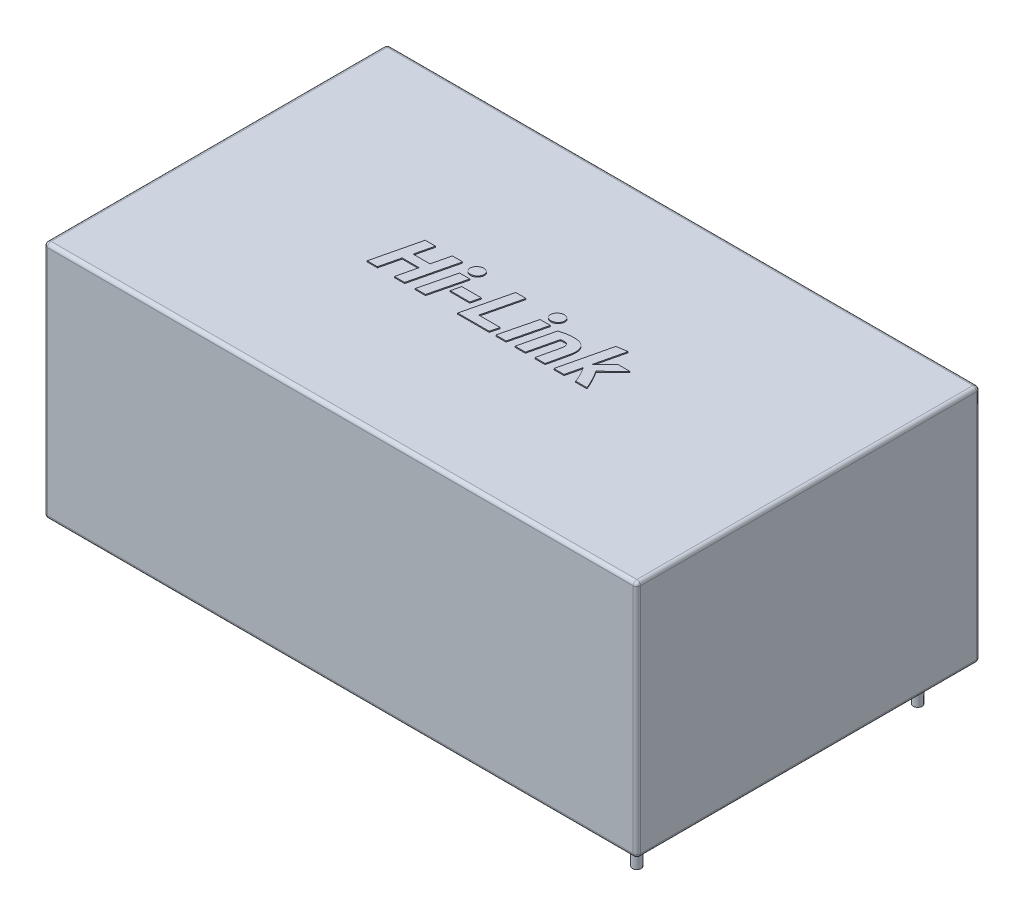
from build123d import *

# Parameters (mm, degrees)
SKETCH1_W           = 57
SKETCH1_H           = 33
BOSS_EXTRUDE2_DEPTH = 23
SKETCH2_R           = 0.423333333
BOSS_EXTRUDE3_DEPTH = 3.5
BOSS_EXTRUDE4_DEPTH = 0.1
FILLET1_R           = 0.35


with BuildPart() as part:
    # Sketch1 → Boss-Extrude2 (new body)
    with BuildSketch(Plane(origin=(0, 0, 0), x_dir=(1, 0, 0), z_dir=(0, 1, 0))):
        with Locations((28.5, 16.5)):
            Rectangle(SKETCH1_W, SKETCH1_H)
    extrude(amount=BOSS_EXTRUDE2_DEPTH)

    # Sketch2 → Boss-Extrude3 (add)
    with BuildSketch(Plane.XZ):
        with Locations(Location((3, -12, 0), (0, 0, 270))):
            Circle(SKETCH2_R)
        with Locations(Location((3, -21, 0), (0, 0, 270))):
            Circle(SKETCH2_R)
        with Locations(Location((54, -30, 0), (0, 0, 270))):
            Circle(SKETCH2_R)
        with Locations(Location((54, -3, 0), (0, 0, 270))):
            Circle(SKETCH2_R)
    extrude(amount=BOSS_EXTRUDE3_DEPTH)

    # Sketch3 → Boss-Extrude4 (add)
    with BuildSketch(Plane(origin=(0, 23, 0), x_dir=(1, 0, 0), z_dir=(0, 1, 0))):
        Polygon((20.950002418, 18.322835056), (21.935314918, 18.322835056), (20.855314918, 13.822835056), (19.870002418, 13.822835056), (20.330314918, 15.742835056), (18.701877418, 15.742835056), (18.240627418, 13.822835056), (17.255314918, 13.822835056), (18.335314918, 18.322835056), (19.320627418, 18.322835056), (18.903439918, 16.582835056), (20.531877418, 16.582835056), align=None)
        Polygon((22.861564918, 13.822835056), (21.875314918, 13.822835056), (22.715314918, 17.242835056), (23.701564918, 17.242835056), align=None)
        with BuildLine():
            add(Edge.make_bspline(
                [(23.339689918, 17.662835056), (23.306433979, 17.664232758), (23.240700813, 17.666995436), (23.144726031, 17.690440037), (23.053704894, 17.728542669), (22.968988952, 17.78001861), (22.894099689, 17.846886831), (22.843544719, 17.934760044), (22.81096536, 18.036511577), (22.807882478, 18.109740561), (22.806252418, 18.148460056)],
                knots=[0, 0, 0, 0, 0.983255354, 1.943487056, 2.90545464, 3.89378719, 4.868872819, 5.839693595, 6.857747755, 8, 8, 8, 8], degree=3))
            add(Edge.make_bspline(
                [(22.806252418, 18.148460056), (22.807040649, 18.170686916), (22.8086143, 18.215061382), (22.81917655, 18.280419225), (22.835932775, 18.344082619), (22.8685501, 18.424629599), (22.923627524, 18.517238093), (23.007008735, 18.614917359), (23.108309823, 18.694137565), (23.204522812, 18.743258751), (23.285904216, 18.775421304), (23.350758884, 18.790258095), (23.417089087, 18.801871083), (23.462134844, 18.802510469), (23.485002418, 18.802835056)],
                knots=[0, 0, 0, 0, 0.766373879, 1.530015036, 2.277671595, 3.032132201, 4.520009294, 5.971815345, 7.437831518, 8.922543867, 9.683137154, 10.448980433, 11.212621591, 12, 12, 12, 12], degree=3))
            add(Edge.make_bspline(
                [(23.485002418, 18.802835056), (23.518259945, 18.801440628), (23.583996247, 18.798684425), (23.679947914, 18.775192109), (23.770811188, 18.73737434), (23.854991581, 18.685398316), (23.929187697, 18.618646824), (23.981824768, 18.531758079), (24.013463747, 18.429347545), (24.016723404, 18.355891525), (24.018439918, 18.317210056)],
                knots=[0, 0, 0, 0, 0.98351686, 1.944003943, 2.906227371, 3.886955096, 4.862300057, 5.830288805, 6.857443963, 8, 8, 8, 8], degree=3))
            add(Edge.make_bspline(
                [(24.018439918, 18.317210056), (24.017625416, 18.294990229), (24.015999315, 18.250629808), (24.005813822, 18.185085219), (23.987565367, 18.121734492), (23.95529695, 18.041230073), (23.901285674, 17.947810386), (23.816753747, 17.85131063), (23.715999234, 17.771576099), (23.601421863, 17.710555276), (23.474172165, 17.670097251), (23.384991908, 17.665281415), (23.339689918, 17.662835056)],
                knots=[0, 0, 0, 0, 0.639017777, 1.275756958, 1.901559514, 2.530643768, 3.766733454, 4.983167187, 6.198505139, 7.440687745, 8.699914764, 10, 10, 10, 10], degree=3))
        make_face()
        Polygon((23.950002418, 16.222835056), (25.835314918, 16.222835056), (25.620627418, 15.322835056), (23.735314918, 15.322835056), align=None)
        Polygon((29.195314918, 14.662835056), (28.988127418, 13.822835056), (25.955314918, 13.822835056), (27.035314918, 18.322835056), (28.020627418, 18.322835056), (27.142189918, 14.662835056), align=None)
        Polygon((30.601564918, 13.822835056), (29.615314918, 13.822835056), (30.455314918, 17.242835056), (31.441564918, 17.242835056), align=None)
        with BuildLine():
            add(Edge.make_bspline(
                [(31.079689918, 17.662835056), (31.046433979, 17.664232758), (30.980700813, 17.666995436), (30.884726031, 17.690440037), (30.793704894, 17.728542669), (30.708988952, 17.78001861), (30.634099689, 17.846886831), (30.583544719, 17.934760044), (30.55096536, 18.036511577), (30.547882478, 18.109740561), (30.546252418, 18.148460056)],
                knots=[0, 0, 0, 0, 0.983255354, 1.943487056, 2.90545464, 3.89378719, 4.868872819, 5.839693595, 6.857747755, 8, 8, 8, 8], degree=3))
            add(Edge.make_bspline(
                [(30.546252418, 18.148460056), (30.547040649, 18.170686916), (30.5486143, 18.215061382), (30.55917655, 18.280419225), (30.575932775, 18.344082619), (30.6085501, 18.424629599), (30.663627524, 18.517238093), (30.747008735, 18.614917359), (30.848309823, 18.694137565), (30.944522812, 18.743258751), (31.025904216, 18.775421304), (31.090758884, 18.790258095), (31.157089087, 18.801871083), (31.202134844, 18.802510469), (31.225002418, 18.802835056)],
                knots=[0, 0, 0, 0, 0.766373879, 1.530015036, 2.277671595, 3.032132201, 4.520009294, 5.971815345, 7.437831518, 8.922543867, 9.683137154, 10.448980433, 11.212621591, 12, 12, 12, 12], degree=3))
            add(Edge.make_bspline(
                [(31.225002418, 18.802835056), (31.258259945, 18.801440628), (31.323996247, 18.798684425), (31.419947914, 18.775192109), (31.510811188, 18.73737434), (31.594991581, 18.685398316), (31.669187697, 18.618646824), (31.721824768, 18.531758079), (31.753463747, 18.429347545), (31.756723404, 18.355891525), (31.758439918, 18.317210056)],
                knots=[0, 0, 0, 0, 0.98351686, 1.944003943, 2.906227371, 3.886955096, 4.862300057, 5.830288805, 6.857443963, 8, 8, 8, 8], degree=3))
            add(Edge.make_bspline(
                [(31.758439918, 18.317210056), (31.757625416, 18.294990229), (31.755999315, 18.250629808), (31.745813822, 18.185085219), (31.727565367, 18.121734492), (31.69529695, 18.041230073), (31.641285674, 17.947810386), (31.556753747, 17.85131063), (31.455999234, 17.771576099), (31.341421863, 17.710555276), (31.214172165, 17.670097251), (31.124991908, 17.665281415), (31.079689918, 17.662835056)],
                knots=[0, 0, 0, 0, 0.639017777, 1.275756958, 1.901559514, 2.530643768, 3.766733454, 4.983167187, 6.198505139, 7.440687745, 8.699914764, 10, 10, 10, 10], degree=3))
        make_face()
        with BuildLine():
            add(Edge.make_bspline(
                [(32.255314918, 17.129397556), (32.29408231, 17.141216563), (32.375397128, 17.166006996), (32.503281167, 17.206270905), (32.644773931, 17.247020206), (32.802560712, 17.284738557), (32.978214861, 17.317993598), (33.137569063, 17.337439188), (33.275441438, 17.35179699), (33.38809155, 17.357371084), (33.507449121, 17.362920051), (33.589369381, 17.362863951), (33.631564918, 17.362835056)],
                knots=[0, 0, 0, 0, 0.866583632, 1.817663976, 2.866737551, 4.014171008, 5.285376548, 6.686864199, 7.445483599, 8.248670064, 9.097923916, 10, 10, 10, 10], degree=3))
            add(Edge.make_bspline(
                [(33.631564918, 17.362835056), (33.69286553, 17.361653708), (33.810808344, 17.359380787), (33.980723001, 17.339916062), (34.135447141, 17.306288302), (34.276049588, 17.261046311), (34.400860103, 17.200610461), (34.511442318, 17.12722404), (34.605744142, 17.038988282), (34.685928778, 16.938480458), (34.749080371, 16.824873898), (34.799757202, 16.700725022), (34.833615321, 16.564623986), (34.854274713, 16.417597543), (34.859302468, 16.259287059), (34.849272558, 16.089686061), (34.824796736, 15.908910294), (34.798350699, 15.785802013), (34.784689918, 15.722210056)],
                knots=[0, 0, 0, 0, 1.208274638, 2.324729008, 3.365164516, 4.325627439, 5.229389122, 6.090571374, 6.93189012, 7.765117222, 8.61485262, 9.485458956, 10.401422209, 11.372007444, 12.407671419, 13.518314389, 14.718077725, 16, 16, 16, 16], degree=3))
            Line((34.784689918, 15.722210056), (34.355314918, 13.822835056))
            Line((34.355314918, 13.822835056), (33.372814918, 13.822835056))
            Line((33.372814918, 13.822835056), (33.801252418, 15.700647556))
            add(Edge.make_bspline(
                [(33.801252418, 15.700647556), (33.813656188, 15.757733925), (33.837690417, 15.868347626), (33.859886777, 16.005555705), (33.872731937, 16.109782409), (33.874283213, 16.182249328), (33.871007019, 16.250072583), (33.860883394, 16.312734086), (33.84418902, 16.370624276), (33.820050181, 16.423151784), (33.785938861, 16.468956232), (33.744684233, 16.50993111), (33.692534785, 16.543930301), (33.62809997, 16.56674584), (33.552161139, 16.580644336), (33.497571051, 16.582072786), (33.468439918, 16.582835056)],
                knots=[0, 0, 0, 0, 2.149310766, 4.164623236, 5.11324992, 6.010510512, 6.828274062, 7.609059554, 8.340435268, 9.040020793, 9.723156681, 10.430636758, 11.170640451, 11.9929998, 12.928996276, 14, 14, 14, 14], degree=3))
            add(Edge.make_bspline(
                [(33.468439918, 16.582835056), (33.407641081, 16.581339775), (33.28437694, 16.578308229), (33.163256421, 16.555180339), (33.101877418, 16.543460056)],
                knots=[0, 0, 0, 0, 0.986480532, 2, 2, 2, 2], degree=3))
            Line((33.101877418, 16.543460056), (32.459689918, 13.822835056))
            Line((32.459689918, 13.822835056), (31.475314918, 13.822835056))
            Line((31.475314918, 13.822835056), (32.255314918, 17.129397556))
        make_face()
        with BuildLine():
            add(Edge.make_bspline(
                [(36.693439918, 15.999710056), (36.804606695, 16.108857509), (37.027730252, 16.327928069), (37.306821728, 16.599441746), (37.524234169, 16.814237712), (37.679674469, 16.964713926), (37.823361711, 17.107607616), (37.916811841, 17.198839304), (37.961877418, 17.242835056)],
                knots=[0, 0, 0, 0, 1.57894289, 3.169106513, 3.946250701, 4.676390778, 5.361700039, 6, 6, 6, 6], degree=3))
            Line((37.961877418, 17.242835056), (39.095314918, 17.242835056))
            add(Edge.make_bspline(
                [(39.095314918, 17.242835056), (38.960632441, 17.110642438), (38.693790588, 16.84873366), (38.360006607, 16.521268277), (38.091179178, 16.257597203), (37.882123073, 16.051959464), (37.663349537, 15.838239832), (37.51467023, 15.692542651), (37.438752418, 15.618147556)],
                knots=[0, 0, 0, 0, 1.463994915, 2.900563783, 3.627418854, 4.38512829, 5.175423066, 6, 6, 6, 6], degree=3))
            add(Edge.make_bspline(
                [(37.438752418, 15.618147556), (37.481755227, 15.558691318), (37.572145607, 15.433716412), (37.696167653, 15.22772531), (37.824066024, 15.006168494), (37.947857297, 14.771644466), (38.071136762, 14.532121801), (38.185208382, 14.290635057), (38.290477572, 14.055556901), (38.3477348, 13.898491549), (38.375314918, 13.822835056)],
                knots=[0, 0, 0, 0, 0.867055329, 1.822519579, 2.84018881, 3.891282842, 4.956902266, 6.024357824, 7.048356906, 8, 8, 8, 8], degree=3))
            Line((38.375314918, 13.822835056), (37.302814918, 13.822835056))
            add(Edge.make_bspline(
                [(37.302814918, 13.822835056), (37.281473672, 13.88272849), (37.236519387, 14.008891063), (37.155693235, 14.200512327), (37.066997078, 14.400895626), (36.966642215, 14.599825627), (36.861761544, 14.793466899), (36.753396561, 14.977396114), (36.644883218, 15.148380181), (36.566854012, 15.253565616), (36.529377418, 15.304085056)],
                knots=[0, 0, 0, 0, 0.909742001, 1.916326755, 2.975248016, 4.04525481, 5.10387383, 6.126279461, 7.100072068, 8, 8, 8, 8], degree=3))
            Line((36.529377418, 15.304085056), (36.178752418, 13.822835056))
            Line((36.178752418, 13.822835056), (35.195314918, 13.822835056))
            Line((35.195314918, 13.822835056), (36.335314918, 18.647210056))
            Line((36.335314918, 18.647210056), (37.356252418, 18.802835056))
            Line((37.356252418, 18.802835056), (36.693439918, 15.999710056))
        make_face()
    extrude(amount=BOSS_EXTRUDE4_DEPTH)

    # Fillet1
    fillet1_edges = [part.edges().sort_by_distance(p)[0] for p in [
        (57, 23, -16.5),
        (28.5, 23, -33),
        (0, 23, -16.5),
        (28.5, 0, -33),
        (57, 0, -16.5),
        (28.5, 0, 0),
        (0, 0, -16.5),
        (28.5, 23, 0),
        (0, 11.5, -33),
        (57, 11.5, -33),
        (57, 11.5, 0),
        (0, 11.5, 0),
    ]]
    fillet(fillet1_edges, radius=FILLET1_R)


solid = part.part
